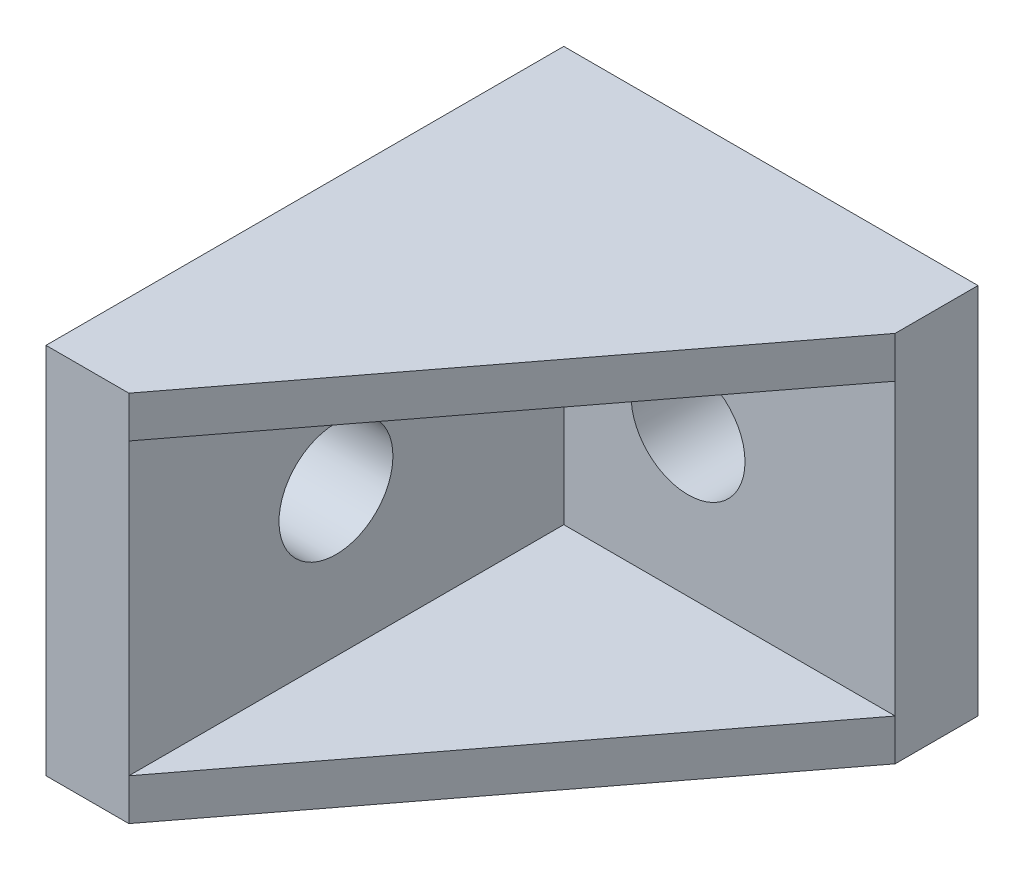
from build123d import *

# Parameters (mm, degrees)
SKETCH_1_W               = 20
SKETCH_1_H               = 18
EXTRUDE_1_DEPTH          = 25
SKETCH_2_W               = 16
SKETCH_2_H               = 14
CUT_EXTRUDE_1_DEPTH      = 21
CUT_EXTRUDE_2_DEPTH      = 32.320919527
CUT_EXTRUDE_2_DEPTH_BACK = 32.320919527
CUT_EXTRUDE_3_DEPTH      = 25.939927827
CUT_EXTRUDE_3_DEPTH_BACK = 25.939927827
SKETCH_5_R               = 2.75
CUT_EXTRUDE_4_DEPTH      = 32.016124839
CUT_EXTRUDE_4_DEPTH_BACK = 32.016124839
SKETCH_6_R               = 2.75


with BuildPart() as part:
    # 스케치1 → 보스-돌출1 (new body)
    with BuildSketch(Plane.XY):
        Rectangle(SKETCH_1_W, SKETCH_1_H)
    extrude(amount=EXTRUDE_1_DEPTH)

    # 스케치2 → 컷-돌출1 (cut)
    with BuildSketch(Plane.XY.offset(25)):
        with Locations((2, 0)):
            Rectangle(SKETCH_2_W, SKETCH_2_H)
    extrude(amount=-CUT_EXTRUDE_1_DEPTH, mode=Mode.SUBTRACT)

    # 스케치4 → 컷-돌출2 (cut, two sides: drawn at the far end of the back side and taken through both)
    with BuildSketch(Plane(origin=(0, -7, 0), x_dir=(1, 0, 0), z_dir=(0, 1, 0)).offset(-CUT_EXTRUDE_2_DEPTH_BACK)):
        Polygon((-6, -25), (10, -4), (10, -25), align=None)
    extrude(amount=CUT_EXTRUDE_2_DEPTH + CUT_EXTRUDE_2_DEPTH_BACK, mode=Mode.SUBTRACT)

    # 스케치5 → 컷-돌출3 (cut, two sides: drawn at the far end of the back side and taken through both)
    with BuildSketch(Plane.XY.offset(4).offset(-CUT_EXTRUDE_3_DEPTH_BACK)):
        Circle(SKETCH_5_R)
    extrude(amount=CUT_EXTRUDE_3_DEPTH + CUT_EXTRUDE_3_DEPTH_BACK, mode=Mode.SUBTRACT)

    # 스케치6 → 컷-돌출4 (cut, two sides: drawn at the far end of the back side and taken through both)
    with BuildSketch(Plane(origin=(-6, 0, 0), x_dir=(0, 0, -1), z_dir=(1, 0, 0)).offset(-CUT_EXTRUDE_4_DEPTH_BACK)):
        with Locations(Location((-15, 0, 0), (0, 0, 90))):
            Circle(SKETCH_6_R)
    extrude(amount=CUT_EXTRUDE_4_DEPTH + CUT_EXTRUDE_4_DEPTH_BACK, mode=Mode.SUBTRACT)


solid = part.part
